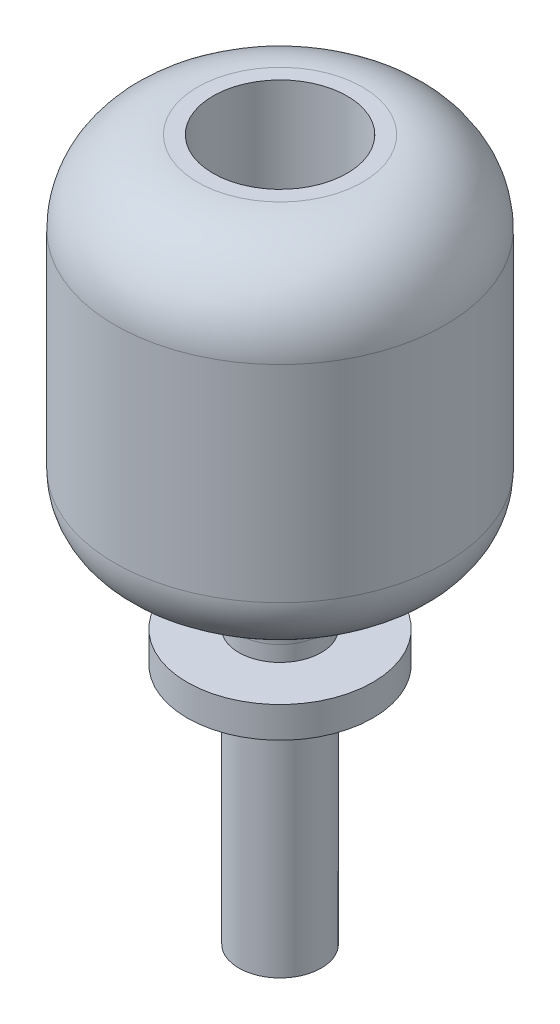
from build123d import *

# Parameters (mm, degrees)
SKETCH_2_R          = 6.5
CUT_EXTRUDE_1_DEPTH = 30
CUT_EXTRUDE_2_REACH = 73.666
SKETCH_3_R          = 2
EXTRUDE_START       = -23.5
SKETCH_4_R          = 9
SKETCH_4_R_2        = 2
EXTRUDE_4_DEPTH     = 3


with BuildPart() as part:
    # 스케치1 → 회전2 (revolve)
    with BuildSketch(Plane.XY, mode=Mode.PRIVATE) as revolve_2_sk:
        with BuildLine():
            Line((0, 54.747282219), (-8, 54.747282219))
            ThreePointArc((-8, 54.747282219), (-13.656854249, 52.404136469), (-16, 46.747282219))
            Line((-16, 46.747282219), (-16, 26.747282219))
            ThreePointArc((-16, 26.747282219), (-14.242640687, 22.504641532), (-10, 20.747282219))
            ThreePointArc((-10, 20.747282219), (-5.757359313, 18.989922906), (-4, 14.747282219))
            Line((-4, 14.747282219), (-4, -13.252717781))
            Line((-4, -13.252717781), (0, -13.252717781))
            Line((0, -13.252717781), (0, 54.747282219))
        make_face()
    revolve(revolve_2_sk.sketch.rotate(Axis((0, 0, 0), (0, 1, 0)), 270), axis=Axis((0, 0, 0), (0, 1, 0)))

    # 스케치2 → 컷-돌출1 (cut)
    with BuildSketch(Plane(origin=(0, 54.747282219, 0), x_dir=(1, 0, 0), z_dir=(0, 1, 0))):
        with Locations(Location((0, 0, 0), (0, 0, 270))):
            Circle(SKETCH_2_R)
    extrude(amount=-CUT_EXTRUDE_1_DEPTH, mode=Mode.SUBTRACT)

    # 스케치3 → 컷-돌출2 (cut, up to next)
    with BuildSketch(Plane.XZ.offset(13.252717781), mode=Mode.PRIVATE) as cut_extrude_2_sk1:
        with Locations(Location((0, 0, 0), (0, 0, 270))):
            Circle(SKETCH_3_R)
    cut_extrude_2_tool1 = extrude(cut_extrude_2_sk1.sketch, amount=-CUT_EXTRUDE_2_REACH, mode=Mode.PRIVATE) & part.part
    add(cut_extrude_2_tool1.solids().sort_by_distance((0, -13.252718, 0))[0], mode=Mode.SUBTRACT)

    # 스케치4 → 보스-돌출4 (add)
    with BuildSketch(Plane.XZ.offset(13.252717781).offset(EXTRUDE_START)):
        with Locations(Location((0, 0, 0), (0, 0, 270))):
            Circle(SKETCH_4_R)
        with Locations(Location((0, 0, 0), (0, 0, 270))):
            Circle(SKETCH_4_R_2, mode=Mode.SUBTRACT)
    extrude(amount=-EXTRUDE_4_DEPTH)


solid = part.part
